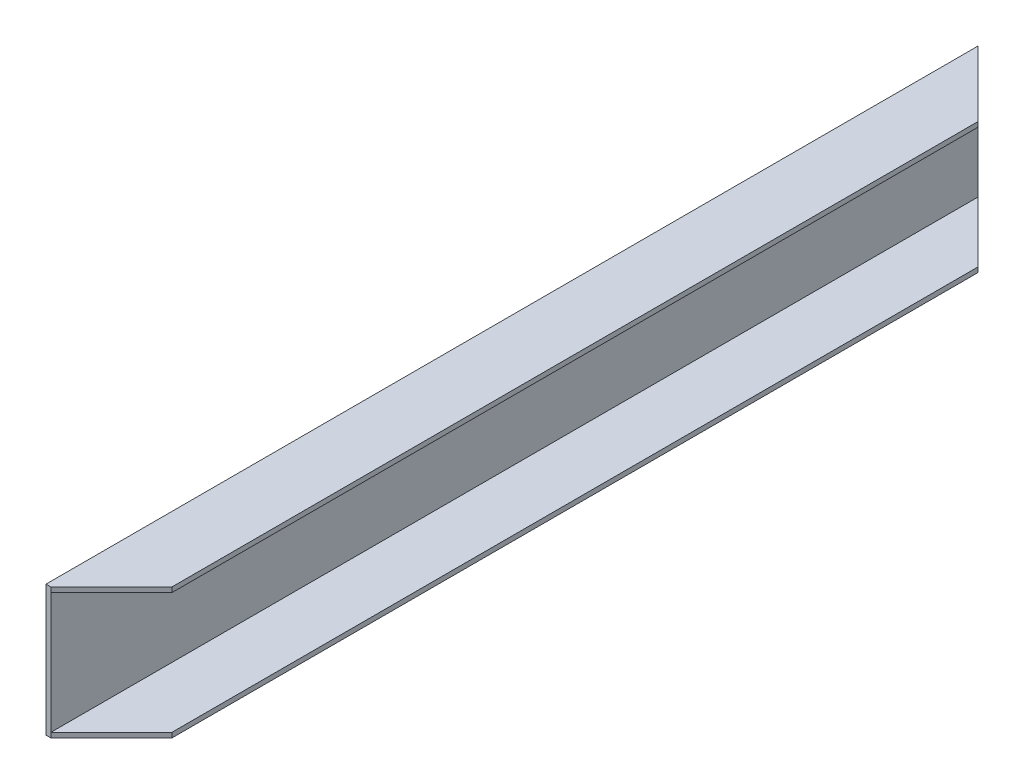
from build123d import *

# Parameters (mm, degrees)
RESSALTO_EXTRUS_O1_DEPTH = 142.5
CORTE_EXTRUS_O1_DEPTH    = 50


with BuildPart() as part:
    # Esboço1 → Ressalto-extrusão1 (new, symmetric)
    with BuildSketch(Plane.XY):
        Polygon((0, 20), (0, -20), (20, -20), (20, -18.5), (1.5, -18.5), (1.5, 18.5), (20, 18.5), (20, 20), align=None)
    extrude(amount=RESSALTO_EXTRUS_O1_DEPTH, both=True)

    # Esboço2 → Corte-extrusão1 (cut, symmetric)
    with BuildSketch(Plane(origin=(0, 20, 0), x_dir=(1, 0, 0), z_dir=(0, 1, 0))):
        Polygon((1.5, -142.5), (20, -124), (20, -142.5), align=None)
        Polygon((0, 142.5), (20, 122.5), (20, 142.5), align=None)
    extrude(amount=CORTE_EXTRUS_O1_DEPTH, both=True, mode=Mode.SUBTRACT)


solid = part.part
